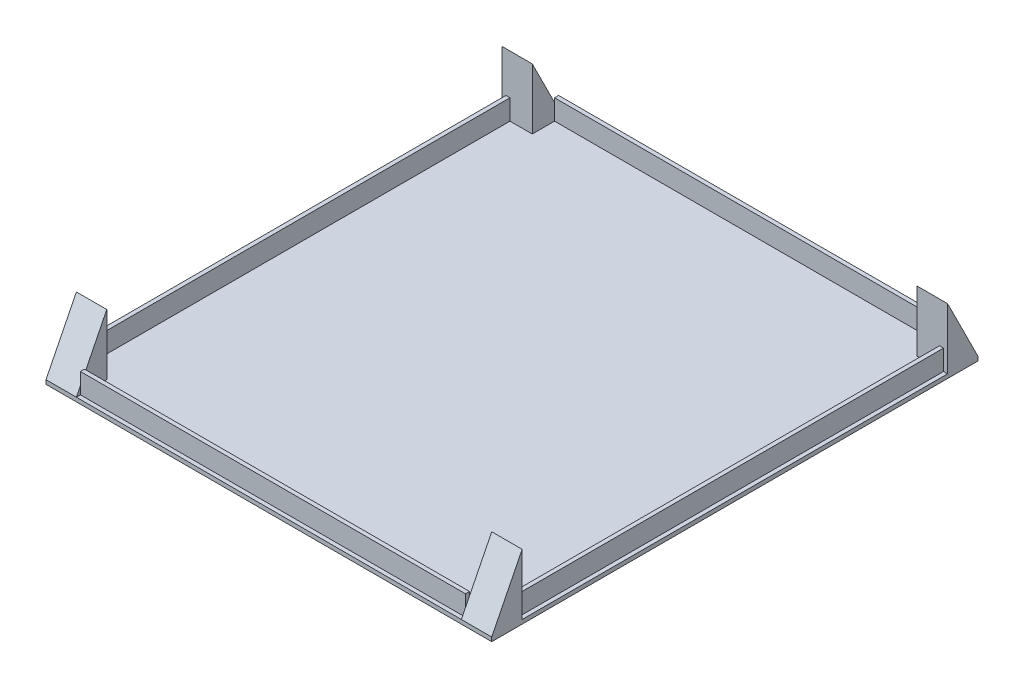
from build123d import *

# Parameters (mm, degrees)
SKETCH2_W           = 220
SKETCH2_H           = 240
BOSS_EXTRUDE1_DEPTH = 2
SKETCH4_W           = 190
SKETCH4_H           = 2
SKETCH4_W_2         = 2
SKETCH4_H_2         = 210
BOSS_EXTRUDE3_DEPTH = 10
BOSS_EXTRUDE4_DEPTH = 15
BOSS_EXTRUDE5_DEPTH = 15


with BuildPart() as part:
    # Sketch2 → Boss-Extrude1 (new body)
    with BuildSketch(Plane(origin=(0, 0, 0), x_dir=(1, 0, 0), z_dir=(0, 1, 0))):
        Rectangle(SKETCH2_W, SKETCH2_H)
    extrude(amount=BOSS_EXTRUDE1_DEPTH)

    # Sketch4 → Boss-Extrude3 (add)
    with BuildSketch(Plane(origin=(0, 2, 0), x_dir=(1, 0, 0), z_dir=(0, 1, 0))):
        with Locations((0, 117)):
            Rectangle(SKETCH4_W, SKETCH4_H)
        with Locations((-107, 0)):
            Rectangle(SKETCH4_W_2, SKETCH4_H_2)
        with Locations((0, -117)):
            Rectangle(SKETCH4_W, SKETCH4_H)
        with Locations((107, 0)):
            Rectangle(SKETCH4_W_2, SKETCH4_H_2)
    extrude(amount=BOSS_EXTRUDE3_DEPTH)

    # Sketch5 → Boss-Extrude4 (add)
    with BuildSketch(Plane(origin=(110, 0, 0), x_dir=(0, 0, -1), z_dir=(1, 0, 0))):
        Polygon((-120, 2), (-105, 2), (-105, 32), align=None)
        Polygon((120, 2), (105, 2), (105, 32), align=None)
    extrude(amount=-BOSS_EXTRUDE4_DEPTH)

    # Sketch6 → Boss-Extrude5 (add)
    with BuildSketch(Plane.ZY.offset(110)):
        Polygon((120, 2), (105, 2), (105, 32), align=None)
        Polygon((-105, 32), (-105, 2), (-120, 2), align=None)
    extrude(amount=-BOSS_EXTRUDE5_DEPTH)


solid = part.part
